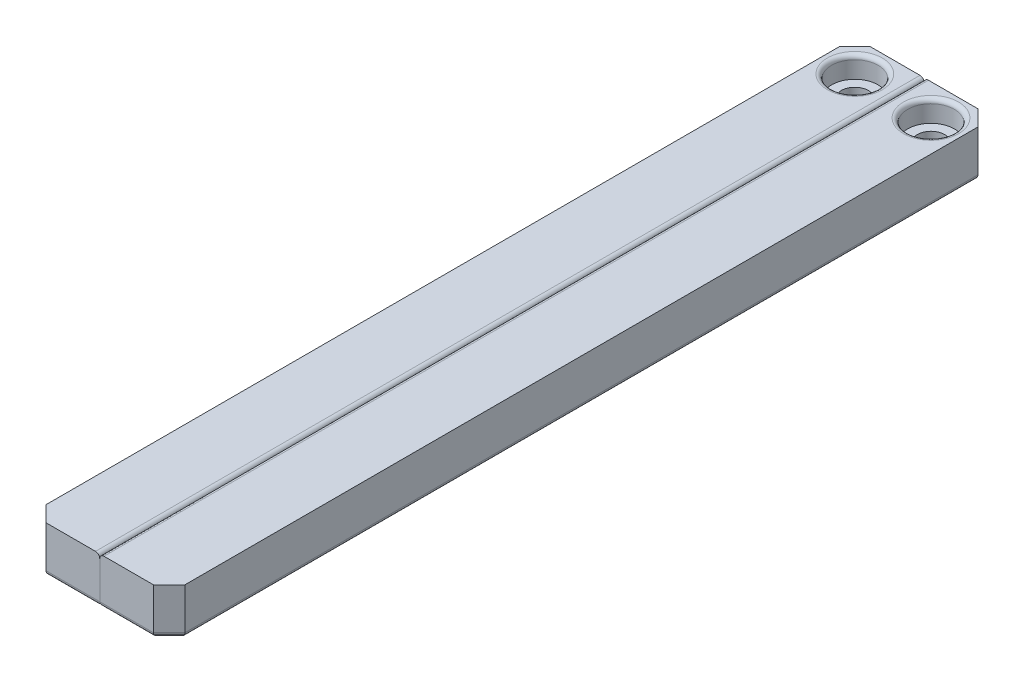
from build123d import *

# Parameters (mm, degrees)
SKETCH_1_W          = 8.2
SKETCH_1_H          = 97.4
EXTRUDE_1_DEPTH     = 5.4
SKETCH_2_R          = 1.6
CUT_EXTRUDE_1_DEPTH = 103.046451594
FILLET_1_R          = 0.5
FILLET_2_R          = 0.5
SKETCH_3_R          = 2.75
CUT_EXTRUDE_2_DEPTH = 2.5
FILLET_3_R          = 0.5


with BuildPart() as part:
    # 草图1 → 凸台-拉伸1 (new body)
    with BuildSketch(Plane(origin=(0, 0, 0), x_dir=(1, 0, 0), z_dir=(0, 1, 0))):
        with Locations((25.859277076, 48.7)):
            Rectangle(SKETCH_1_W, SKETCH_1_H)
    extrude(amount=EXTRUDE_1_DEPTH)

    # 草图2 → 切除-拉伸1 (cut, through all)
    with BuildSketch(Plane(origin=(0, 5.4, 0), x_dir=(1, 0, 0), z_dir=(0, 1, 0))):
        with Locations(Location((25.459277076, 93.7, 0), (0, 0, 270))):
            Circle(SKETCH_2_R)
        Polygon((21.759277076, 97.4), (23.609277076, 97.4), (21.759277076, 95.55), align=None)
        Polygon((21.759277076, 0), (23.609277076, 0), (21.759277076, 1.85), align=None)
    extrude(amount=-CUT_EXTRUDE_1_DEPTH, mode=Mode.SUBTRACT)

    # 圆角1
    fillet_1_edges = [part.edges().sort_by_distance(p)[0] for p in [
        (21.759277076, 0, -48.7),
        (26.784277076, 0, 0),
        (22.684277076, 0, -96.475),
        (22.684277076, 0, -0.925),
        (25.459277076, 0, -95.3),
        (26.784277076, 0, -97.4),
        (29.959277076, 0, -48.7),
    ]]
    fillet(fillet_1_edges, radius=FILLET_1_R)

    # 圆角2
    fillet_2_edges = [part.edges().sort_by_distance(p)[0] for p in [
        (29.959277076, 5.4, -48.7),
    ]]
    fillet(fillet_2_edges, radius=FILLET_2_R)

    # 草图3 → 切除-拉伸2 (cut)
    with BuildSketch(Plane(origin=(0, 5.4, 0), x_dir=(1, 0, 0), z_dir=(0, 1, 0))):
        with Locations(Location((25.459277076, 93.7, 0), (0, 0, 270))):
            Circle(SKETCH_3_R)
    extrude(amount=-CUT_EXTRUDE_2_DEPTH, mode=Mode.SUBTRACT)

    # 圆角3
    fillet_3_edges = [part.edges().sort_by_distance(p)[0] for p in [
        (25.459277076, 5.4, -96.45),
    ]]
    fillet(fillet_3_edges, radius=FILLET_3_R)


with BuildPart() as body_2:
    # 镜向1: mirrored copy
    add(part.part.mirror(Plane(origin=(29.959277076, 5.4, 0), x_dir=(0, 0, 1), z_dir=(-1, 0, 0))))


solid = Compound([part.part, body_2.part])
